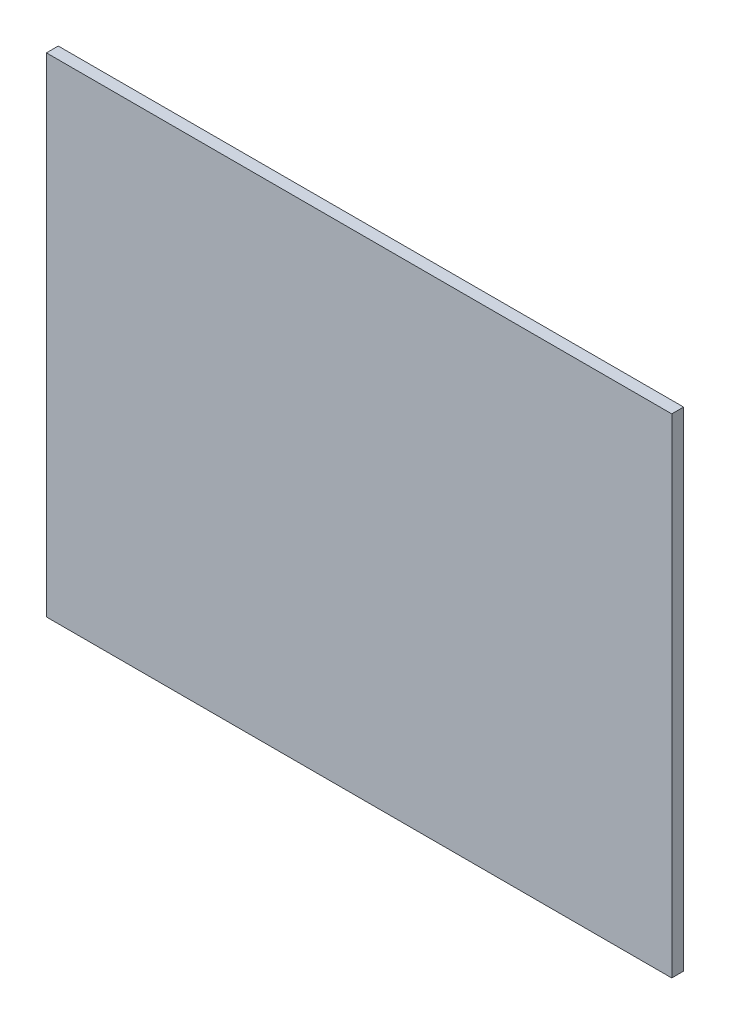
from build123d import *

# Parameters (mm, degrees)
SKETCH1_W           = 15.383745154
SKETCH1_H           = 635
BOSS_EXTRUDE1_DEPTH = 812.8


with BuildPart() as part:
    # Sketch1 → Boss-Extrude1 (new body)
    with BuildSketch(Plane(origin=(0, 0, 0), x_dir=(0, 0, -1), z_dir=(1, 0, 0))):
        Rectangle(SKETCH1_W, SKETCH1_H)
    extrude(amount=BOSS_EXTRUDE1_DEPTH)


solid = part.part
